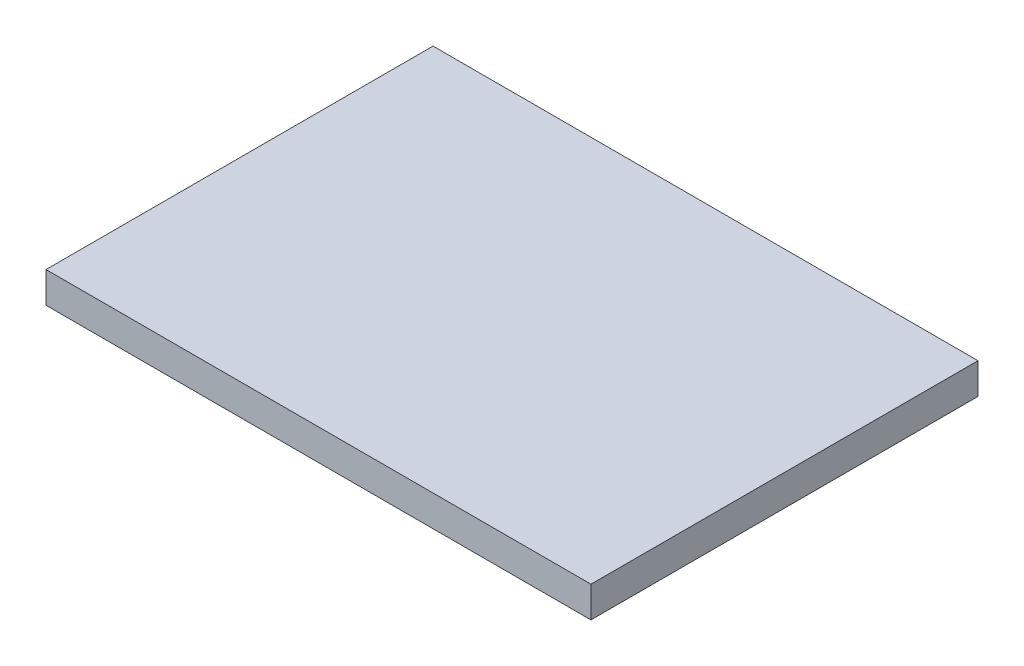
from build123d import *

# Parameters (mm, degrees)
SKETCH1_W           = 35.2
SKETCH1_H           = 25
BOSS_EXTRUDE1_DEPTH = 2


with BuildPart() as part:
    # Sketch1 → Boss-Extrude1 (new body)
    with BuildSketch(Plane(origin=(0, 0, 0), x_dir=(1, 0, 0), z_dir=(0, 1, 0))):
        Rectangle(SKETCH1_W, SKETCH1_H)
    extrude(amount=BOSS_EXTRUDE1_DEPTH)


solid = part.part
